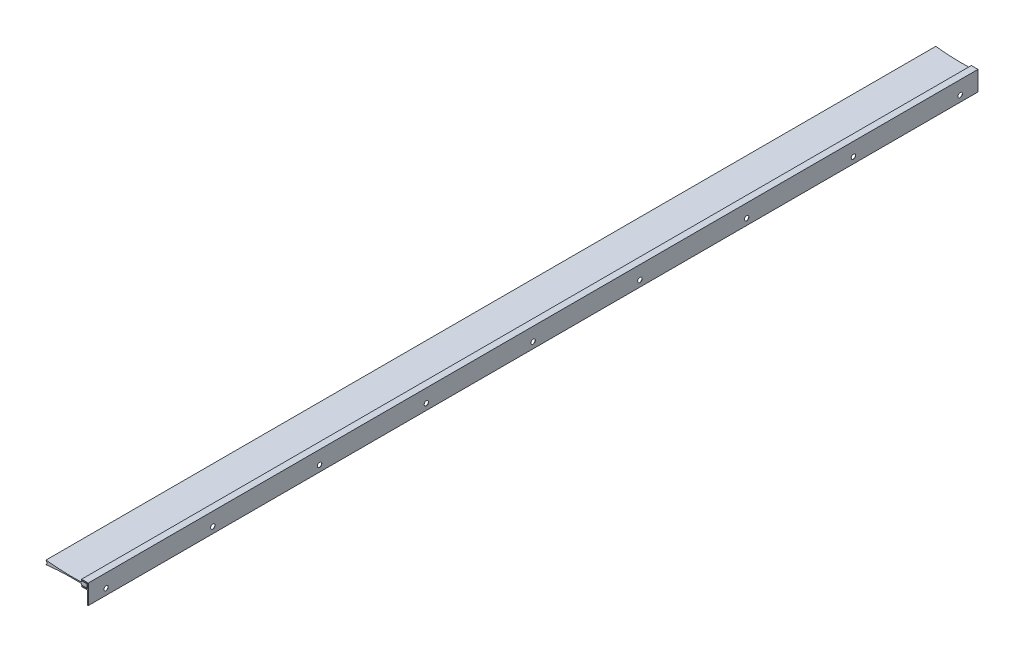
from build123d import *

# Parameters (mm, degrees)
BOSS_EXTRUDE1_DEPTH  = 500
BOSS_EXTRUDE2_DEPTH  = 1000
LPATTERN1_COUNT      = 8
LPATTERN1_PITCH      = 120
LPATTERN1_COUNT_DIR2 = 8
LPATTERN1_PITCH_DIR2 = 120


with BuildPart() as part:
    # Sketch1 → Boss-Extrude1 (new, symmetric)
    with BuildSketch(Plane.XY):
        Polygon((0, 7.2), (7.5, 7.2), (7.5, -14.8), (6.5, -14.8), (6.5, 0), (0, 0), (0, 1), (6.5, 1), (6.5, 6.2), (0, 6.2), align=None)
    extrude(amount=BOSS_EXTRUDE1_DEPTH, both=True)

    # Sketch4 → CSK for M3 Hex Socket Countersunk Head Screw1 (revolve, cut)
    with BuildSketch(Plane(origin=(6.5, -7.8, 0), x_dir=(0, 0, 1), z_dir=(0, 1, 0))):
        Polygon((0, 0), (0, 11.021463052), (1.7, 10), (1.7, 1.77), (3.47, 0), align=None)
    csk_for_m3_hex_socket_countersunk_head_s = revolve(axis=Axis((0.15, -7.8, 0), (1, 0, 0)), mode=Mode.SUBTRACT)

    # LPattern1: CSK for M3 Hex Socket Countersunk Head S 8 × 8
    with Locations(*[Vector(0, 0, -1) * (i * LPATTERN1_PITCH) + Vector(0, 0, 1) * (j * LPATTERN1_PITCH_DIR2) for i in range(LPATTERN1_COUNT) for j in range(LPATTERN1_COUNT_DIR2) if (i, j) != (0, 0)]):
        add(csk_for_m3_hex_socket_countersunk_head_s, mode=Mode.SUBTRACT)


with BuildPart() as body_2:
    # Sketch2 → Boss-Extrude2 (new body)
    with BuildSketch(Plane.XY.offset(500)):
        with BuildLine():
            Line((0, 5.7), (6, 5.7))
            Line((6, 5.7), (6, 1.5))
            Line((6, 1.5), (0, 1.5))
            Line((0, 1.5), (0, 2.9))
            ThreePointArc((0, 2.9), (-20.029717879, 2.9), (-40, 1.358108202))
            Line((-40, 1.358108202), (-38.5, 3.6))
            Line((-38.5, 3.6), (-40, 5.841891798))
            ThreePointArc((-40, 5.841891798), (-20.029717879, 4.3), (0, 4.3))
            Line((0, 4.3), (0, 5.7))
        make_face()
    extrude(amount=-BOSS_EXTRUDE2_DEPTH)


solid = Compound([part.part, body_2.part])
